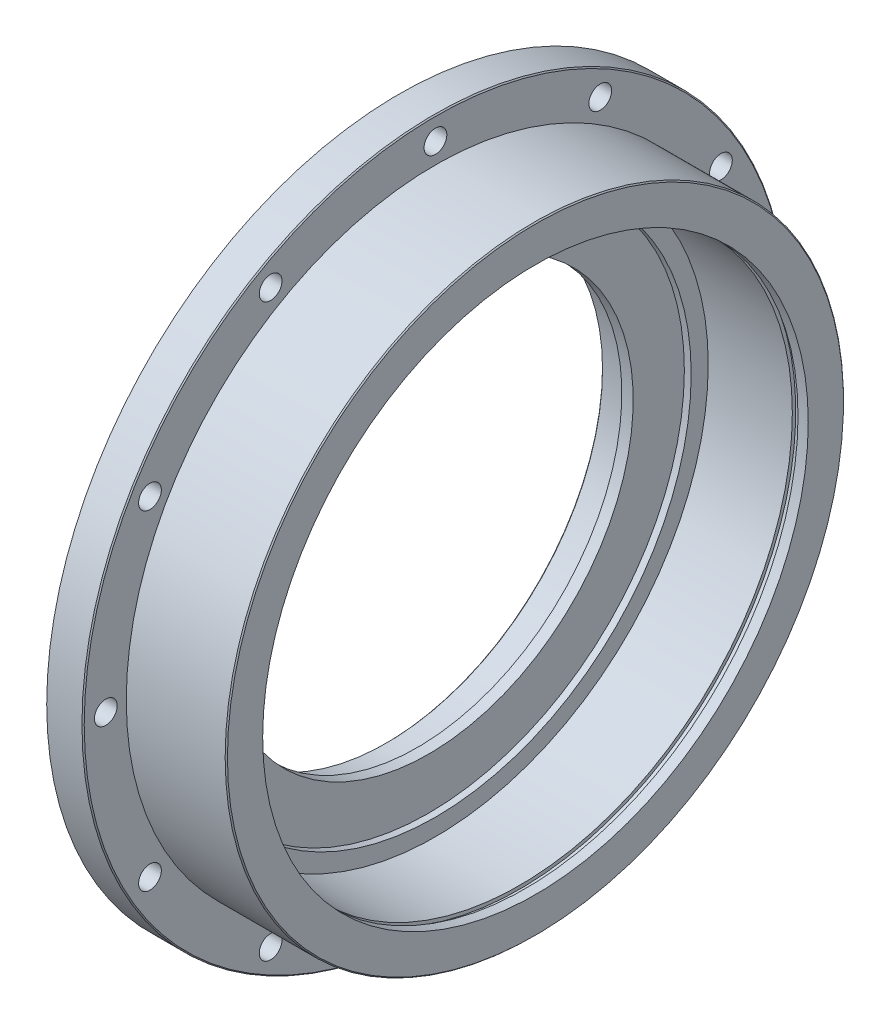
from build123d import *

# Parameters (mm, degrees)
SKETCH_3_R          = 5
CUT_EXTRUDE_1_DEPTH = 228.266363547
CHAMFER_1_SIZE      = 0.5


with BuildPart() as part:
    # 草图1 → 旋转1 (revolve)
    with BuildSketch(Plane.XY, mode=Mode.PRIVATE) as revolve_1_sk:
        Polygon((0, 0), (0, 120), (6, 120), (6, 155), (22, 155), (22, 136), (66, 136), (66, 0), align=None)
    revolve(revolve_1_sk.sketch.rotate(Axis((0, 0, 0), (1, 0, 0)), 90), axis=Axis((0, 0, 0), (1, 0, 0)))

    # 草图2 → 切除-旋转1 (revolve, cut)
    with BuildSketch(Plane.XY, mode=Mode.PRIVATE) as cut_revolve_1_sk:
        Polygon((0, 0), (0, 95), (14, 95), (14, 90), (19, 90), (19, 112.5), (22, 112.5), (22, 120), (59, 120), (59, 121.5), (61.5, 121.5), (61.5, 120), (66, 120), (66, 0), align=None)
    revolve(cut_revolve_1_sk.sketch.rotate(Axis((0, 0, 0), (1, 0, 0)), 90), axis=Axis((0, 0, 0), (1, 0, 0)), mode=Mode.SUBTRACT)

    # 草图3 → 切除-拉伸1 (cut, through all)
    with BuildSketch(Plane.ZY.offset(-6)):
        with Locations((0, 145)):
            Circle(SKETCH_3_R)
        with Locations((72.5, 125.573683549)):
            Circle(SKETCH_3_R)
        with Locations((125.573683549, 72.5)):
            Circle(SKETCH_3_R)
        with Locations((145, 0)):
            Circle(SKETCH_3_R)
        with Locations((125.573683549, -72.5)):
            Circle(SKETCH_3_R)
        with Locations((72.5, -125.573683549)):
            Circle(SKETCH_3_R)
        with Locations((0, -145)):
            Circle(SKETCH_3_R)
        with Locations((-72.5, -125.573683549)):
            Circle(SKETCH_3_R)
        with Locations((-125.573683549, -72.5)):
            Circle(SKETCH_3_R)
        with Locations((-145, 0)):
            Circle(SKETCH_3_R)
        with Locations((-125.573683549, 72.5)):
            Circle(SKETCH_3_R)
        with Locations((-72.5, 125.573683549)):
            Circle(SKETCH_3_R)
    extrude(amount=-CUT_EXTRUDE_1_DEPTH, mode=Mode.SUBTRACT)

    # 倒角1
    chamfer_1_edges = [part.edges().sort_by_distance(p)[0] for p in [
        (0, 0, -95),
        (66, 0, -136),
        (22, 0, -155),
    ]]
    chamfer(chamfer_1_edges, length=CHAMFER_1_SIZE)


solid = part.part
